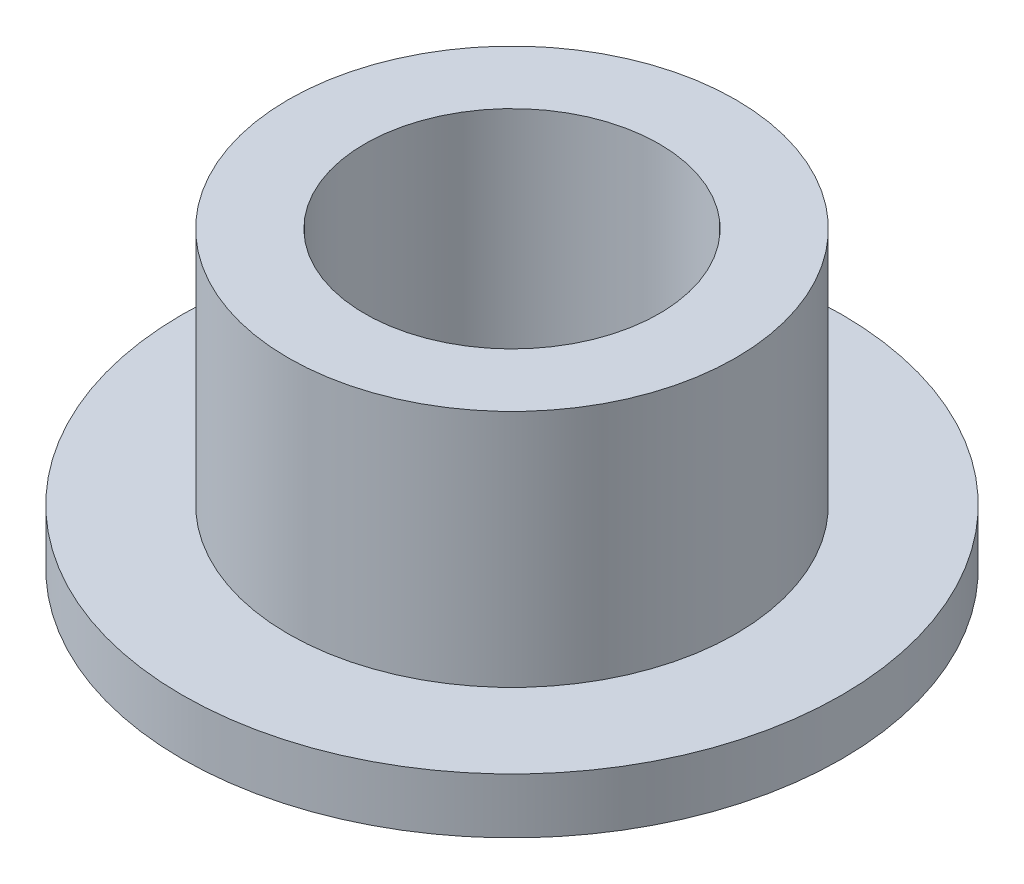
from build123d import *

# Parameters (mm, degrees)
SKETCH1_R           = 7.112
BOSS_EXTRUDE1_DEPTH = 1.1938
SKETCH3_R           = 4.826
BOSS_EXTRUDE2_DEPTH = 6.35
SKETCH4_R           = 3.175
CUT_EXTRUDE1_DEPTH  = 12.894687386


with BuildPart() as part:
    # Sketch1 → Boss-Extrude1 (new body)
    with BuildSketch(Plane(origin=(0, 0, 0), x_dir=(1, 0, 0), z_dir=(0, 1, 0))):
        Circle(SKETCH1_R)
    extrude(amount=BOSS_EXTRUDE1_DEPTH)

    # Sketch3 → Boss-Extrude2 (add)
    with BuildSketch(Plane(origin=(0, 0, 0), x_dir=(1, 0, 0), z_dir=(0, 1, 0))):
        Circle(SKETCH3_R)
    extrude(amount=BOSS_EXTRUDE2_DEPTH)

    # Sketch4 → Cut-Extrude1 (cut, through all)
    with BuildSketch(Plane.XZ):
        Circle(SKETCH4_R)
    extrude(amount=-CUT_EXTRUDE1_DEPTH, mode=Mode.SUBTRACT)


solid = part.part
